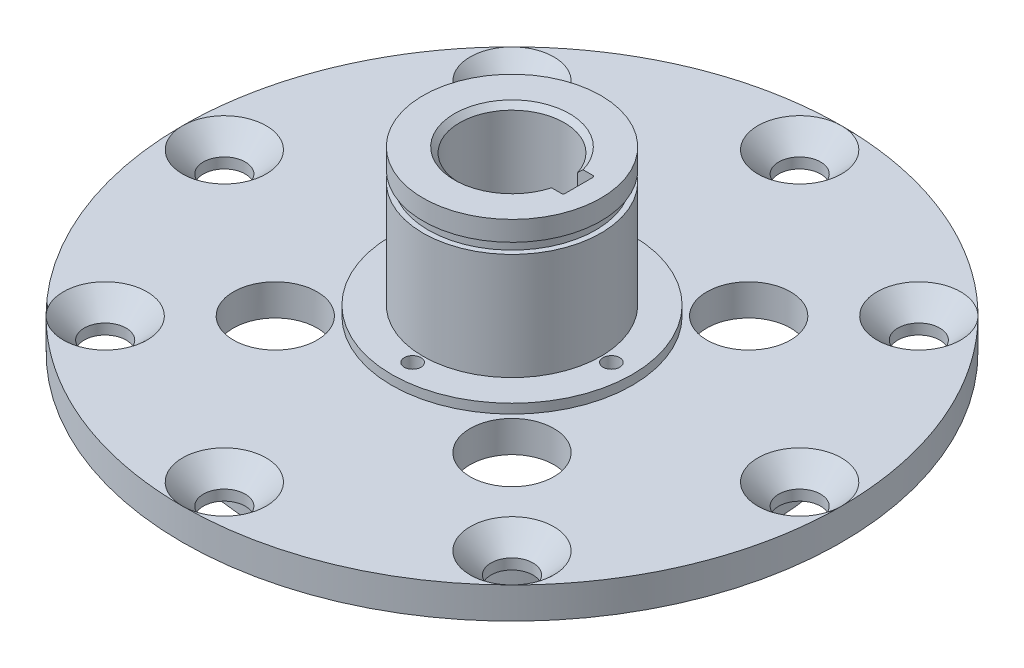
from build123d import *

# Parameters (mm, degrees)
HOLE_WIZARD_1_D           = 4
HOLE_WIZARD_1_CSINK_D     = 8
HOLE_WIZARD_1_CSINK_ANGLE = 90
CUT_EXTRUDE_1_DEPTH       = 48.716978111
SKETCH_12_R               = 8.5
EXTRUDE_1_DEPTH           = 1.9
FILLET_2_R                = 0.15
CHAMFER_3_SIZE            = 0.5
HOLE_WIZARD_M2_1_D        = 1.6
SKETCH_11_R               = 4
CUT_EXTRUDE_2_DEPTH       = 47.695824224


with BuildPart() as part:
    # 草图1 → 旋转1 (revolve)
    with BuildSketch(Plane.XY, mode=Mode.PRIVATE) as revolve_1_sk:
        Polygon((24.5, 0), (31.5, 0), (31.5, 3), (11.5, 3), (11.5, 3.9), (8.5, 3.9), (8.5, 14.1), (8, 14.1), (8, 15.1), (5, 15.1), (5, 0), (20, 0), (20, -2), (24.5, -2), align=None)
    revolve(revolve_1_sk.sketch.rotate(Axis((0, 57.09591982, 0), (0, -1, 0)), 90), axis=Axis((0, 57.09591982, 0), (0, -1, 0)))

    # 打孔尺寸(%根据十字)槽半沉头木螺钉的类型1 (through all)
    with Locations(Plane(origin=(0, 3, 0), x_dir=(-1, 0, 0), z_dir=(0, 1, 0))):
        with Locations((0, 27.5), (-19.445436483, -19.445436483), (-27.5, 0), (-19.445436483, 19.445436483), (0, -27.5), (19.445436483, -19.445436483), (27.5, 0), (19.445436483, 19.445436483)):
            CounterSinkHole(HOLE_WIZARD_1_D / 2, HOLE_WIZARD_1_CSINK_D / 2, counter_sink_angle=HOLE_WIZARD_1_CSINK_ANGLE)

    # 草图7 → 切除-拉伸1 (cut, through all)
    with BuildSketch(Plane(origin=(0, 15.1, 0), x_dir=(1, 0, 0), z_dir=(0, 1, 0))):
        with BuildLine():
            Line((6.4, -1.5), (6.4, 1.5))
            Line((6.4, 1.5), (4.769696007, 1.5))
            ThreePointArc((4.769696007, 1.5), (5, 0), (4.769696007, -1.5))
            Line((4.769696007, -1.5), (6.4, -1.5))
        make_face()
    extrude(amount=-CUT_EXTRUDE_1_DEPTH, mode=Mode.SUBTRACT)

    # 草图12 → 凸台-拉伸1 (add)
    with BuildSketch(Plane(origin=(0, 15.1, 0), x_dir=(1, 0, 0), z_dir=(0, 1, 0))):
        with Locations(Location((0, 0, 0), (0, 0, 270))):
            Circle(SKETCH_12_R)
        with BuildLine():
            Line((6.4, 1.5), (4.769696007, 1.5))
            ThreePointArc((4.769696007, 1.5), (-5, 0), (4.769696007, -1.5))
            Line((4.769696007, -1.5), (6.4, -1.5))
            Line((6.4, -1.5), (6.4, 1.5))
        make_face(mode=Mode.SUBTRACT)
    extrude(amount=EXTRUDE_1_DEPTH)

    # 圆角2
    fillet_2_edges = [part.edges().sort_by_distance(p)[0] for p in [
        (6.4, 7.55, -1.5),
        (6.4, 7.55, 1.5),
    ]]
    fillet(fillet_2_edges, radius=FILLET_2_R)

    # 倒角3
    chamfer_3_edges = [part.edges().sort_by_distance(p)[0] for p in [
        (-5, 17, 0),
        (-5, 0, 0),
    ]]
    chamfer(chamfer_3_edges, length=CHAMFER_3_SIZE)

    # M2 螺纹孔1 (through all)
    with Locations(Plane(origin=(0, 3.9, 0), x_dir=(1, 0, 0), z_dir=(0, 1, 0))):
        with Locations((9.5, 0), (0, -9.5), (0, 9.5), (-9.5, 0)):
            Hole(HOLE_WIZARD_M2_1_D / 2)

    # 草图11 → 切除-拉伸2 (cut, through all)
    with BuildSketch(Plane(origin=(0, 3, 0), x_dir=(1, 0, 0), z_dir=(0, 1, 0))):
        with Locations(Location((11.313708499, 11.313708499, 0), (0, 0, 270))):
            Circle(SKETCH_11_R)
        with Locations(Location((11.313708499, -11.313708499, 0), (0, 0, 270))):
            Circle(SKETCH_11_R)
        with Locations(Location((-11.313708499, -11.313708499, 0), (0, 0, 270))):
            Circle(SKETCH_11_R)
        with Locations(Location((-11.313708499, 11.313708499, 0), (0, 0, 270))):
            Circle(SKETCH_11_R)
    extrude(amount=-CUT_EXTRUDE_2_DEPTH, mode=Mode.SUBTRACT)


solid = part.part
